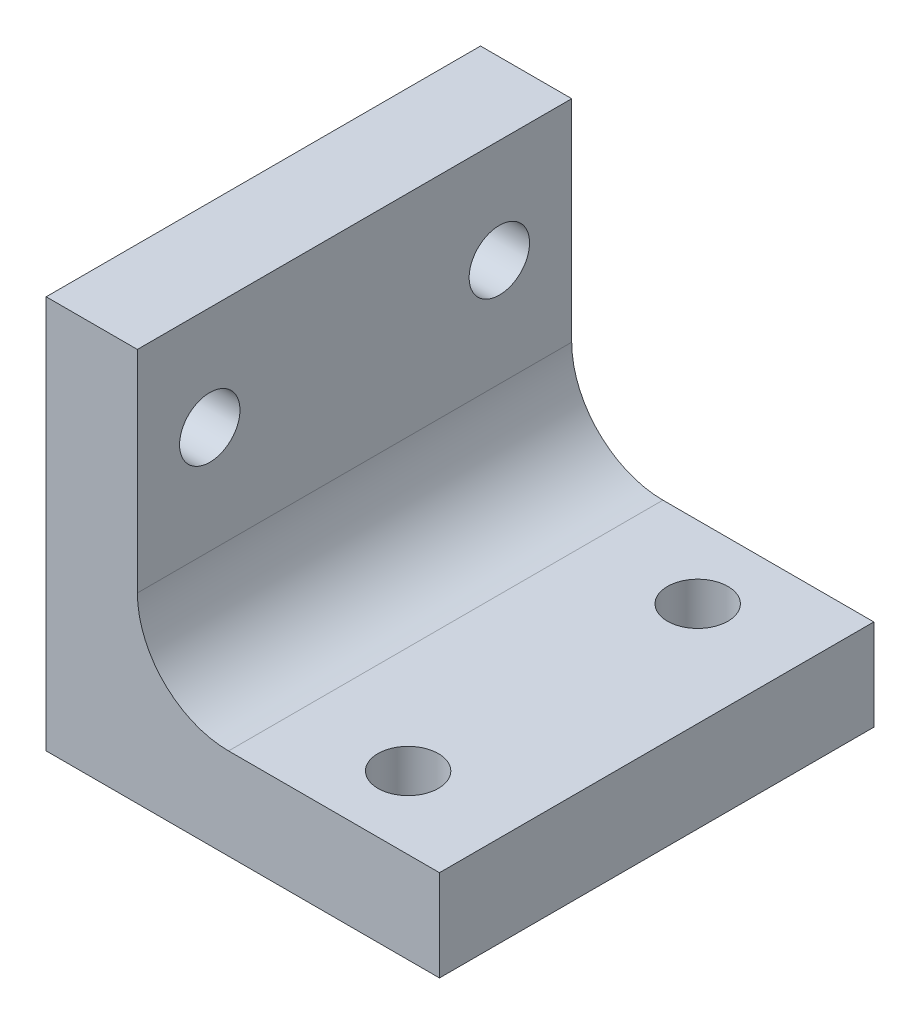
from build123d import *

# Parameters (mm, degrees)
BOSS_EXTRUDE1_DEPTH  = 19.05
M5_CLEARANCE_HOLE1_D = 5.3
FILLET1_R            = 8


with BuildPart() as part:
    # Sketch1 → Boss-Extrude1 (new, symmetric)
    with BuildSketch(Plane.XY):
        Polygon((0, 0), (34.5, 0), (34.5, 8), (8, 8), align=None)
    extrude(amount=BOSS_EXTRUDE1_DEPTH, both=True)

    # M5 Clearance Hole1 (through all)
    with Locations(Plane(origin=(0, 8, 0), x_dir=(1, 0, 0), z_dir=(0, 1, 0))):
        with Locations((25.4, 12.7), (25.4, -12.7)):
            Hole(M5_CLEARANCE_HOLE1_D / 2)

    # Mirror1: part across plane


with BuildPart() as part_1:
    add(part.part)
    add(part.part.mirror(Plane(origin=(0, 0, 19.05), x_dir=(0, 0, 1), z_dir=(0.7071067811865475, -0.7071067811865478, 0))))

    # Fillet1
    fillet1_edges = [part_1.edges().sort_by_distance(p)[0] for p in [
        (8, 8, 0),
    ]]
    fillet(fillet1_edges, radius=FILLET1_R)


solid = part_1.part
